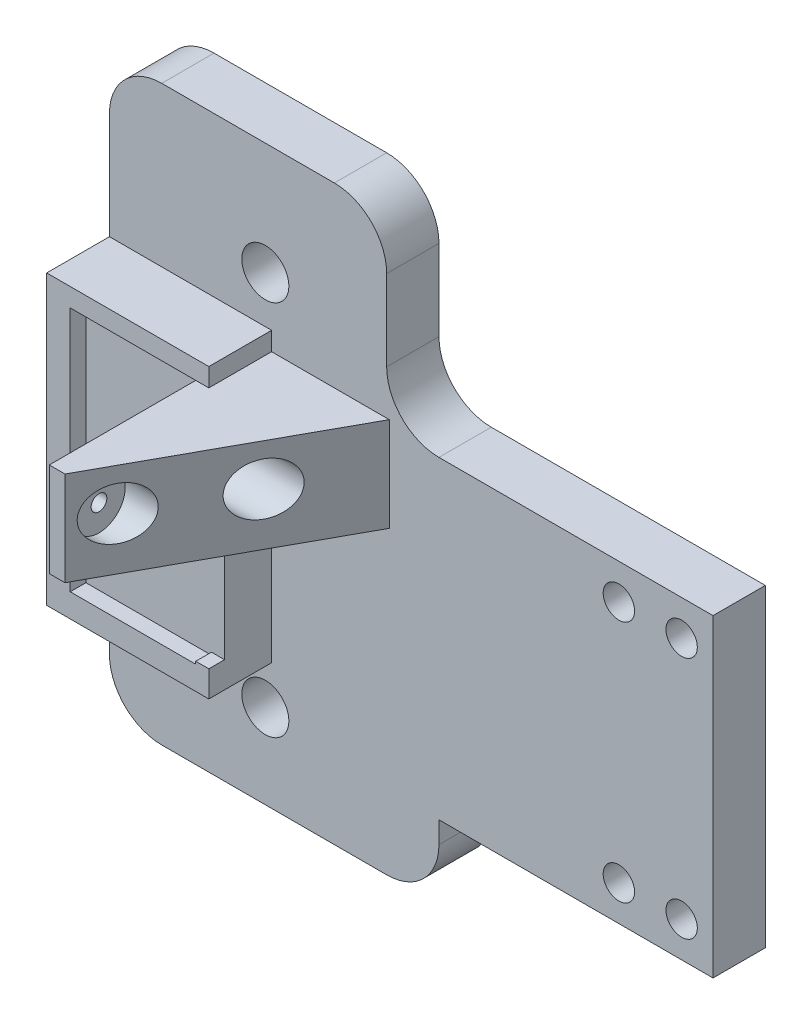
from build123d import *

# Parameters (mm, degrees)
BOSS_EXTRUDE1_DEPTH = 10
SKETCH1_3_W         = 31
SKETCH1_3_H         = 55.042796233
BOSS_EXTRUDE2_DEPTH = 19
BOSS_EXTRUDE3_DEPTH = 3
SKETCH8_W           = 25
SKETCH8_H           = 18
BOSS_EXTRUDE4_DEPTH = 40
CUT_EXTRUDE2_DEPTH  = 101.93603831
SKETCH11_R          = 1.5
CUT_EXTRUDE3_DEPTH  = 365.137190302
SKETCH12_R          = 5
CUT_EXTRUDE4_DEPTH  = 21.5
SKETCH13_R          = 4.5
CUT_EXTRUDE5_DEPTH  = 359.488203344
SKETCH14_R          = 3
CUT_EXTRUDE6_DEPTH  = 359.488203344


with BuildPart() as part:
    # Sketch1 → Boss-Extrude1 (new body)
    with BuildSketch(Plane.XY):
        with BuildLine():
            ThreePointArc((3.70003333, -250.511159837), (0.771101142, -243.440092025), (-6.29996667, -240.511159837))
            Line((-6.29996667, -240.511159837), (-39.29996667, -240.511159837))
            ThreePointArc((-39.29996667, -240.511159837), (-46.371034482, -243.440092025), (-49.29996667, -250.511159837))
            Line((-49.29996667, -250.511159837), (-49.29996667, -340.06501156))
            ThreePointArc((-49.29996667, -340.06501156), (-46.371034482, -347.136079372), (-39.29996667, -350.06501156))
            Line((-39.29996667, -350.06501156), (3.70003333, -350.06501156))
            ThreePointArc((3.70003333, -350.06501156), (10.771101142, -347.136079372), (13.70003333, -340.06501156))
            Line((13.70003333, -340.06501156), (13.70003333, -335.947269399))
            Line((13.70003333, -335.947269399), (66.09296194, -335.947269399))
            Line((66.09296194, -335.947269399), (66.09296194, -275.947269399))
            Line((66.09296194, -275.947269399), (13.70003333, -275.947269399))
            ThreePointArc((13.70003333, -275.947269399), (6.628965518, -273.018337211), (3.70003333, -265.947269399))
            Line((3.70003333, -265.947269399), (3.70003333, -250.511159837))
        make_face()
    extrude(amount=BOSS_EXTRUDE1_DEPTH)

    # Sketch1<3> → Boss-Extrude2 (add)
    with BuildSketch(Plane.XY):
        with Locations((-33.79996667, -298.425871282)):
            Rectangle(SKETCH1_3_W, SKETCH1_3_H)
    extrude(amount=BOSS_EXTRUDE2_DEPTH)

    # Sketch2 → Boss-Extrude3 (add)
    with BuildSketch(Plane.XY.offset(19)):
        Polygon((-44.79996667, -321.447269399), (-44.79996667, -274.447269399), (-20.79996667, -274.447269399), (-20.79996667, -292.147269399), (-18.29996667, -292.147269399), (-18.29996667, -270.904473166), (-49.29996667, -270.904473166), (-49.29996667, -325.947269399), (-18.29996667, -325.947269399), (-18.29996667, -320.947269399), (-20.79996667, -320.947269399), (-20.79996667, -321.447269399), align=None)
    extrude(amount=BOSS_EXTRUDE3_DEPTH)

    # Sketch8 → Boss-Extrude4 (add)
    with BuildSketch(Plane.XY.offset(10)):
        with Locations((-8.29996667, -283.447269399)):
            Rectangle(SKETCH8_W, SKETCH8_H)
    extrude(amount=BOSS_EXTRUDE4_DEPTH)

    # Sketch9 → Cut-Extrude2 (cut, through all)
    with BuildSketch(Plane.XZ.offset(292.447269399)):
        Polygon((-17.79996667, 50), (4.20003333, 10), (4.20003333, 50), align=None)
    extrude(amount=-CUT_EXTRUDE2_DEPTH, mode=Mode.SUBTRACT)

    # Sketch11 → Cut-Extrude3 (cut, through all)
    with BuildSketch(Plane.ZY.offset(20.79996667)):
        with Locations(Location((43.5, -282.447269399, 0), (0, 0, 270))):
            Circle(SKETCH11_R)
        with Locations(Location((25.5, -282.447269399, 0), (0, 0, 270))):
            Circle(SKETCH11_R)
    extrude(amount=-CUT_EXTRUDE3_DEPTH, mode=Mode.SUBTRACT)

    # Sketch12 → Cut-Extrude4 (cut)
    with BuildSketch(Plane(origin=(3.70003333, 0, 0), x_dir=(0, 0, -1), z_dir=(1, 0, 0))):
        with Locations(Location((-43.5, -282.447269399, 0), (0, 0, 90))):
            Circle(SKETCH12_R)
        with Locations(Location((-25.5, -282.447269399, 0), (0, 0, 90))):
            Circle(SKETCH12_R)
    extrude(amount=-CUT_EXTRUDE4_DEPTH, mode=Mode.SUBTRACT)

    # Sketch13 → Cut-Extrude5 (cut, through all)
    with BuildSketch(Plane.XY.offset(10)):
        with Locations((-19.49996667, -261.947269399)):
            Circle(SKETCH13_R)
        with Locations((-19.49996667, -333.947269399)):
            Circle(SKETCH13_R)
    extrude(amount=-CUT_EXTRUDE5_DEPTH, mode=Mode.SUBTRACT)

    # Sketch14 → Cut-Extrude6 (cut, through all)
    with BuildSketch(Plane.XY.offset(10)):
        with Locations((60.09296194, -282.697269399)):
            Circle(SKETCH14_R)
        with Locations((48.092961938, -282.697269399)):
            Circle(SKETCH14_R)
        with Locations(Location((60.09296194, -329.197269399, 0), (0, 0, 180))):
            Circle(SKETCH14_R)
        with Locations(Location((48.092961938, -329.197269399, 0), (0, 0, 180))):
            Circle(SKETCH14_R)
    extrude(amount=-CUT_EXTRUDE6_DEPTH, mode=Mode.SUBTRACT)


solid = part.part
